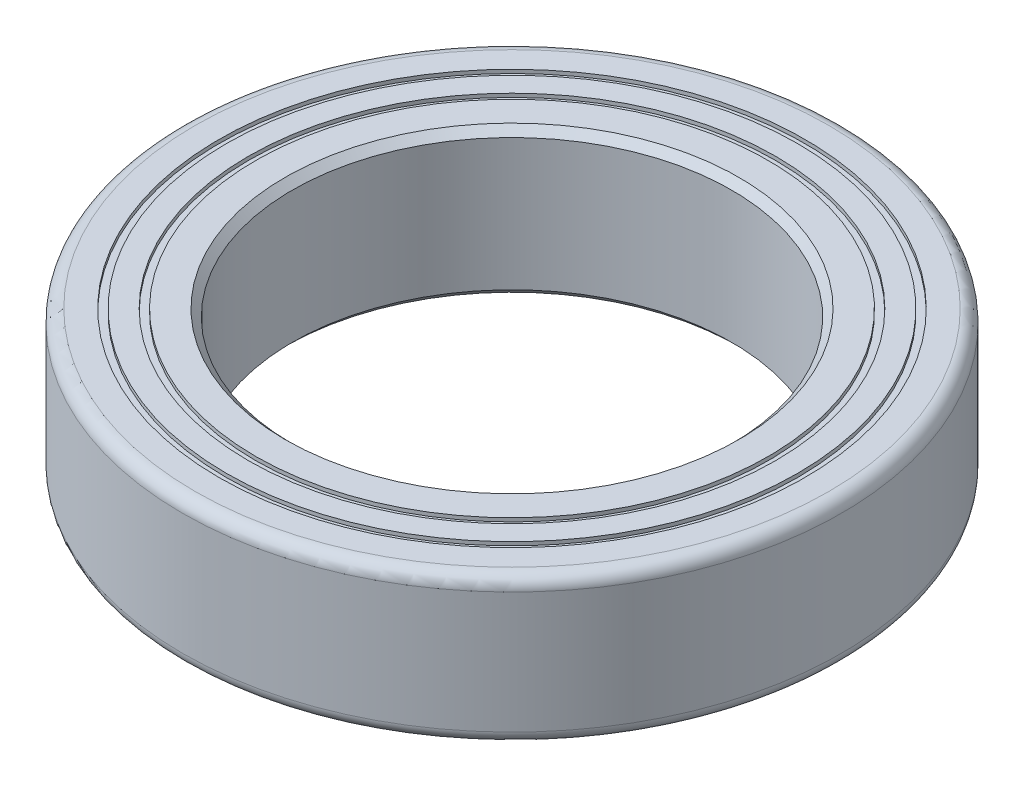
from build123d import *

# Parameters (mm, degrees)
FILLET2_R     = 0.344
CHAMFER2_SIZE = 0.2


with BuildPart() as part:
    # Sketch1 → Revolve1 (revolve)
    with BuildSketch(Plane.XY, mode=Mode.PRIVATE) as revolve1_sk:
        Polygon((9, 0), (9, 4), (8, 4), (8, 3.9), (7.8, 3.9), (7.8, 4), (7.2, 4), (7.2, 3.9), (7, 3.9), (7, 4), (6, 4), (6, 0), (7, 0), (7, 0.1), (7.2, 0.1), (7.2, 0), (7.8, 0), (7.8, 0.1), (8, 0.1), (8, 0), align=None)
    revolve(revolve1_sk.sketch.rotate(Axis((0, 2, 0), (0, -1, 0)), 90), axis=Axis((0, 2, 0), (0, -1, 0)))

    # Fillet2
    fillet2_edges = [part.edges().sort_by_distance(p)[0] for p in [
        (0, 0, -9),
        (0, 4, -9),
    ]]
    fillet(fillet2_edges, radius=FILLET2_R)

    # Chamfer2
    chamfer2_edges = [part.edges().sort_by_distance(p)[0] for p in [
        (0, 4, -6),
        (0, 0, -6),
    ]]
    chamfer(chamfer2_edges, length=CHAMFER2_SIZE)


solid = part.part
